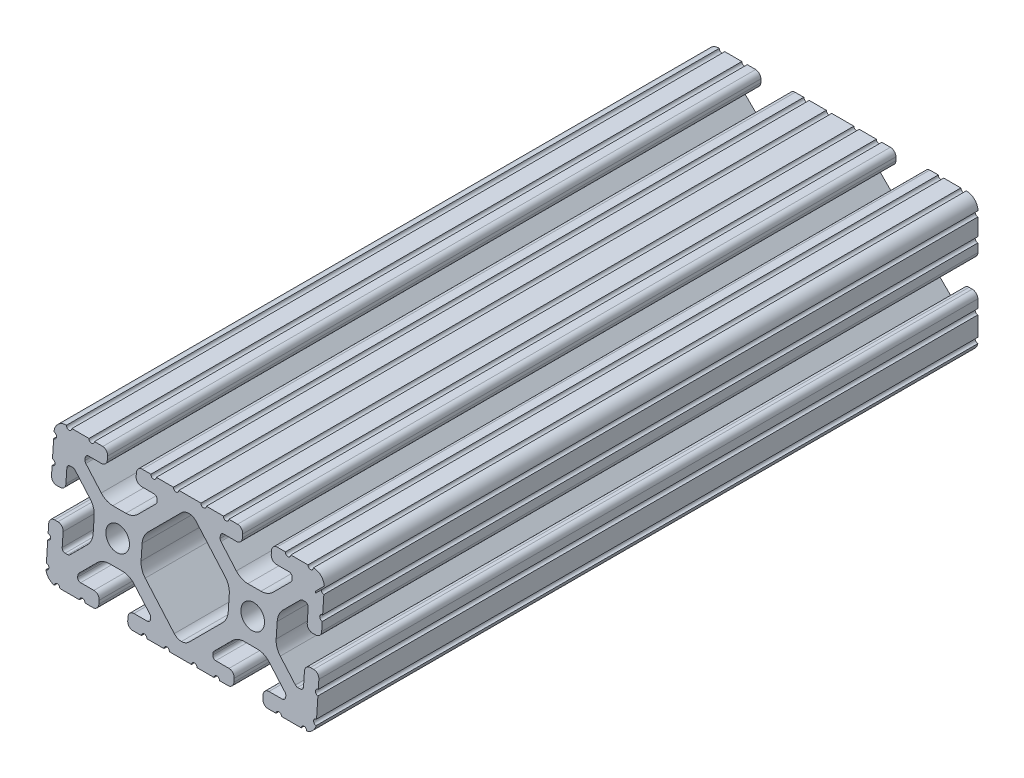
from build123d import *

# Parameters (mm, degrees)
SKETCH1_R          = 3.3274
EXTRUDE1_DEPTH     = 186.817
CUT_EXTRUDE1_DEPTH = 127


with BuildPart() as part:
    # Sketch1 → Extrude1 (new body)
    with BuildSketch(Plane.XY):
        with BuildLine():
            Line((-3.121121376, -19.05), (3.121121376, -19.05))
            ThreePointArc((3.121121376, -19.05), (3.883121376, -18.288), (4.645121376, -19.05))
            Line((4.645121376, -19.05), (8.633115796, -19.05))
            Line((8.633115796, -19.05), (9.473536067, -19.05))
            ThreePointArc((9.473536067, -19.05), (10.235536067, -18.288), (10.997536067, -19.05))
            Line((10.997536067, -19.05), (13.4112, -19.05))
            ThreePointArc((13.4112, -19.05), (14.524751759, -18.588751759), (14.986, -17.4752))
            Line((14.986, -17.4752), (14.986, -16.5608))
            ThreePointArc((14.986, -16.5608), (14.524751759, -15.447248241), (13.4112, -14.986))
            Line((13.4112, -14.986), (9.652, -14.986))
            ThreePointArc((9.652, -14.986), (9.023382072, -14.725617928), (8.763, -14.097))
            Line((8.763, -14.097), (8.763, -13.687179678))
            ThreePointArc((8.763, -13.687179678), (8.830670671, -13.346975131), (9.023380503, -13.058563318))
            Line((9.023380503, -13.058563318), (13.852498595, -8.229421131))
            ThreePointArc((13.852498595, -8.229421131), (15.393447522, -7.199787805), (17.211122763, -6.838228541))
            Line((17.211122763, -6.838228541), (20.888877237, -6.838228541))
            ThreePointArc((20.888877237, -6.838228541), (22.706552478, -7.199787805), (24.247501405, -8.229421131))
            Line((24.247501405, -8.229421131), (29.076619497, -13.058563318))
            ThreePointArc((29.076619497, -13.058563318), (29.269329329, -13.346975131), (29.337, -13.687179678))
            Line((29.337, -13.687179678), (29.337, -14.097))
            ThreePointArc((29.337, -14.097), (29.076617928, -14.725617928), (28.448, -14.986))
            Line((28.448, -14.986), (24.6888, -14.986))
            ThreePointArc((24.6888, -14.986), (23.575248241, -15.447248241), (23.114, -16.5608))
            Line((23.114, -16.5608), (23.114, -17.4752))
            ThreePointArc((23.114, -17.4752), (23.575248241, -18.588751759), (24.6888, -19.05))
            Line((24.6888, -19.05), (26.945817469, -19.05))
            ThreePointArc((26.945817469, -19.05), (27.707817469, -18.288), (28.469817469, -19.05))
            Line((28.469817469, -19.05), (29.207115796, -19.05))
            Line((29.207115796, -19.05), (34.047273398, -19.05))
            ThreePointArc((34.047273398, -19.05), (34.809273398, -18.288), (35.571273398, -19.05))
            ThreePointArc((35.571273398, -19.05), (37.207577603, -18.182738167), (38.1, -16.560019212))
            ThreePointArc((38.1, -16.560019212), (37.338, -15.798019212), (38.1, -15.036019212))
            Line((38.1, -15.036019212), (38.1, -10.287))
            Line((38.1, -10.287), (38.1, -9.549701672))
            ThreePointArc((38.1, -9.549701672), (37.338, -8.787701672), (38.1, -8.025701672))
            Line((38.1, -8.025701672), (38.1, -5.6388))
            ThreePointArc((38.1, -5.6388), (37.638751759, -4.525248241), (36.5252, -4.064))
            Line((36.5252, -4.064), (35.6108, -4.064))
            ThreePointArc((35.6108, -4.064), (34.497248241, -4.525248241), (34.036, -5.6388))
            Line((34.036, -5.6388), (34.036, -9.398))
            ThreePointArc((34.036, -9.398), (33.775617928, -10.026617928), (33.147, -10.287))
            Line((33.147, -10.287), (32.420656743, -10.287))
            ThreePointArc((32.420656743, -10.287), (32.080450147, -10.21932848), (31.792037247, -10.02661636))
            Line((31.792037247, -10.02661636), (27.197575832, -5.43213202))
            ThreePointArc((27.197575832, -5.43213202), (26.167954729, -3.891188903), (25.8064, -2.07352461))
            Line((25.8064, -2.07352461), (25.8064, 2.07352461))
            ThreePointArc((25.8064, 2.07352461), (26.167954729, 3.891188903), (27.197575832, 5.43213202))
            Line((27.197575832, 5.43213202), (31.792037247, 10.02661636))
            ThreePointArc((31.792037247, 10.02661636), (32.080450147, 10.21932848), (32.420656743, 10.287))
            Line((32.420656743, 10.287), (33.147, 10.287))
            ThreePointArc((33.147, 10.287), (33.775617928, 10.026617928), (34.036, 9.398))
            Line((34.036, 9.398), (34.036, 5.6388))
            ThreePointArc((34.036, 5.6388), (34.497248241, 4.525248241), (35.6108, 4.064))
            Line((35.6108, 4.064), (36.5252, 4.064))
            ThreePointArc((36.5252, 4.064), (37.638751759, 4.525248241), (38.1, 5.6388))
            Line((38.1, 5.6388), (38.1, 8.025701672))
            ThreePointArc((38.1, 8.025701672), (37.338, 8.787701672), (38.1, 9.549701672))
            Line((38.1, 9.549701672), (38.1, 10.287))
            Line((38.1, 10.287), (38.1, 14.375206214))
            ThreePointArc((38.1, 14.375206214), (37.338232276, 15.156019383), (38.137614868, 15.89827725))
            ThreePointArc((38.137614868, 15.89827725), (37.148019028, 18.192014021), (34.819536496, 19.096833012))
            ThreePointArc((34.819536496, 19.096833012), (34.081312886, 18.311776389), (33.296256263, 19.05))
            Line((33.296256263, 19.05), (29.207115796, 19.05))
            Line((29.207115796, 19.05), (28.469817468, 19.05))
            ThreePointArc((28.469817468, 19.05), (27.707817468, 18.288), (26.945817468, 19.05))
            Line((26.945817468, 19.05), (24.558915796, 19.05))
            ThreePointArc((24.558915796, 19.05), (23.53023695, 18.547208069), (23.114, 17.480565346))
            Line((23.114, 17.480565346), (23.114, 16.5608))
            ThreePointArc((23.114, 16.5608), (23.575248241, 15.447248241), (24.6888, 14.986))
            Line((24.6888, 14.986), (28.295243665, 14.986))
            ThreePointArc((28.295243665, 14.986), (28.923861593, 14.725617928), (29.184243665, 14.097))
            Line((29.184243665, 14.097), (29.184243665, 13.53442258))
            ThreePointArc((29.184243665, 13.53442258), (29.116572993, 13.194218033), (28.923863161, 12.90580622))
            Line((28.923863161, 12.90580622), (24.247501405, 8.229421131))
            ThreePointArc((24.247501405, 8.229421131), (22.706552478, 7.199787805), (20.888877237, 6.838228541))
            Line((20.888877237, 6.838228541), (17.211122763, 6.838228541))
            ThreePointArc((17.211122763, 6.838228541), (15.393447522, 7.199787805), (13.852498595, 8.229421131))
            Line((13.852498595, 8.229421131), (9.176136839, 12.90580622))
            ThreePointArc((9.176136839, 12.90580622), (8.983427007, 13.194218033), (8.915756335, 13.53442258))
            Line((8.915756335, 13.53442258), (8.915756335, 14.097))
            ThreePointArc((8.915756335, 14.097), (9.176138407, 14.725617928), (9.804756335, 14.986))
            Line((9.804756335, 14.986), (13.4112, 14.986))
            ThreePointArc((13.4112, 14.986), (14.524751759, 15.447248241), (14.986, 16.5608))
            Line((14.986, 16.5608), (14.986, 17.496772581))
            ThreePointArc((14.986, 17.496772581), (14.531070222, 18.595070222), (13.432772581, 19.05))
            Line((13.432772581, 19.05), (10.997536067, 19.05))
            ThreePointArc((10.997536067, 19.05), (10.235536067, 18.288), (9.473536067, 19.05))
            Line((9.473536067, 19.05), (8.633115796, 19.05))
            Line((8.633115796, 19.05), (4.645121376, 19.05))
            ThreePointArc((4.645121376, 19.05), (3.883121376, 18.288), (3.121121376, 19.05))
            Line((3.121121376, 19.05), (-3.121121376, 19.05))
            ThreePointArc((-3.121121376, 19.05), (-3.883121376, 18.288), (-4.645121376, 19.05))
            Line((-4.645121376, 19.05), (-8.633115796, 19.05))
            Line((-8.633115796, 19.05), (-9.473536067, 19.05))
            ThreePointArc((-9.473536067, 19.05), (-10.235536067, 18.288), (-10.997536067, 19.05))
            Line((-10.997536067, 19.05), (-13.432772581, 19.05))
            ThreePointArc((-13.432772581, 19.05), (-14.531070222, 18.595070222), (-14.986, 17.496772581))
            Line((-14.986, 17.496772581), (-14.986, 16.5608))
            ThreePointArc((-14.986, 16.5608), (-14.524751759, 15.447248241), (-13.4112, 14.986))
            Line((-13.4112, 14.986), (-9.804756335, 14.986))
            ThreePointArc((-9.804756335, 14.986), (-9.176138407, 14.725617928), (-8.915756335, 14.097))
            Line((-8.915756335, 14.097), (-8.915756335, 13.53442258))
            ThreePointArc((-8.915756335, 13.53442258), (-8.983427007, 13.194218033), (-9.176136839, 12.90580622))
            Line((-9.176136839, 12.90580622), (-13.852498595, 8.229421131))
            ThreePointArc((-13.852498595, 8.229421131), (-15.393447522, 7.199787805), (-17.211122763, 6.838228541))
            Line((-17.211122763, 6.838228541), (-20.888877237, 6.838228541))
            ThreePointArc((-20.888877237, 6.838228541), (-22.706552478, 7.199787805), (-24.247501405, 8.229421131))
            Line((-24.247501405, 8.229421131), (-28.923863161, 12.90580622))
            ThreePointArc((-28.923863161, 12.90580622), (-29.116572993, 13.194218033), (-29.184243665, 13.53442258))
            Line((-29.184243665, 13.53442258), (-29.184243665, 14.097))
            ThreePointArc((-29.184243665, 14.097), (-28.923861593, 14.725617928), (-28.295243665, 14.986))
            Line((-28.295243665, 14.986), (-24.6888, 14.986))
            ThreePointArc((-24.6888, 14.986), (-23.575248241, 15.447248241), (-23.114, 16.5608))
            Line((-23.114, 16.5608), (-23.114, 17.480565346))
            ThreePointArc((-23.114, 17.480565346), (-23.53023695, 18.547208069), (-24.558915796, 19.05))
            Line((-24.558915796, 19.05), (-26.945817468, 19.05))
            ThreePointArc((-26.945817468, 19.05), (-27.707817468, 18.288), (-28.469817468, 19.05))
            Line((-28.469817468, 19.05), (-29.207115796, 19.05))
            Line((-29.207115796, 19.05), (-33.296256263, 19.05))
            ThreePointArc((-33.296256263, 19.05), (-34.081312886, 18.311776389), (-34.819536496, 19.096833012))
            ThreePointArc((-34.819536496, 19.096833012), (-37.148019028, 18.192014021), (-38.137614868, 15.89827725))
            ThreePointArc((-38.137614868, 15.89827725), (-37.338232276, 15.156019383), (-38.1, 14.375206214))
            Line((-38.1, 14.375206214), (-38.1, 10.287))
            Line((-38.1, 10.287), (-38.1, 9.549701672))
            ThreePointArc((-38.1, 9.549701672), (-37.338, 8.787701672), (-38.1, 8.025701672))
            Line((-38.1, 8.025701672), (-38.1, 5.6388))
            ThreePointArc((-38.1, 5.6388), (-37.638751759, 4.525248241), (-36.5252, 4.064))
            Line((-36.5252, 4.064), (-35.6108, 4.064))
            ThreePointArc((-35.6108, 4.064), (-34.497248241, 4.525248241), (-34.036, 5.6388))
            Line((-34.036, 5.6388), (-34.036, 9.398))
            ThreePointArc((-34.036, 9.398), (-33.775617928, 10.026617928), (-33.147, 10.287))
            Line((-33.147, 10.287), (-32.420656743, 10.287))
            ThreePointArc((-32.420656743, 10.287), (-32.080450147, 10.21932848), (-31.792037247, 10.02661636))
            Line((-31.792037247, 10.02661636), (-27.197575832, 5.43213202))
            ThreePointArc((-27.197575832, 5.43213202), (-26.167954729, 3.891188903), (-25.8064, 2.07352461))
            Line((-25.8064, 2.07352461), (-25.8064, -2.07352461))
            ThreePointArc((-25.8064, -2.07352461), (-26.167954729, -3.891188903), (-27.197575832, -5.43213202))
            Line((-27.197575832, -5.43213202), (-31.792037247, -10.02661636))
            ThreePointArc((-31.792037247, -10.02661636), (-32.080450147, -10.21932848), (-32.420656743, -10.287))
            Line((-32.420656743, -10.287), (-33.147, -10.287))
            ThreePointArc((-33.147, -10.287), (-33.775617928, -10.026617928), (-34.036, -9.398))
            Line((-34.036, -9.398), (-34.036, -5.6388))
            ThreePointArc((-34.036, -5.6388), (-34.497248241, -4.525248241), (-35.6108, -4.064))
            Line((-35.6108, -4.064), (-36.5252, -4.064))
            ThreePointArc((-36.5252, -4.064), (-37.638751759, -4.525248241), (-38.1, -5.6388))
            Line((-38.1, -5.6388), (-38.1, -8.025701672))
            ThreePointArc((-38.1, -8.025701672), (-37.338, -8.787701672), (-38.1, -9.549701672))
            Line((-38.1, -9.549701672), (-38.1, -10.287))
            Line((-38.1, -10.287), (-38.1, -15.036019212))
            ThreePointArc((-38.1, -15.036019212), (-37.338, -15.798019212), (-38.1, -16.560019212))
            ThreePointArc((-38.1, -16.560019212), (-37.20882252, -18.184002456), (-35.571273398, -19.05))
            ThreePointArc((-35.571273398, -19.05), (-34.809273398, -18.288), (-34.047273398, -19.05))
            Line((-34.047273398, -19.05), (-29.207115796, -19.05))
            Line((-29.207115796, -19.05), (-28.469817469, -19.05))
            ThreePointArc((-28.469817469, -19.05), (-27.707817469, -18.288), (-26.945817469, -19.05))
            Line((-26.945817469, -19.05), (-24.6888, -19.05))
            ThreePointArc((-24.6888, -19.05), (-23.575248241, -18.588751759), (-23.114, -17.4752))
            Line((-23.114, -17.4752), (-23.114, -16.5608))
            ThreePointArc((-23.114, -16.5608), (-23.575248241, -15.447248241), (-24.6888, -14.986))
            Line((-24.6888, -14.986), (-28.448, -14.986))
            ThreePointArc((-28.448, -14.986), (-29.076617928, -14.725617928), (-29.337, -14.097))
            Line((-29.337, -14.097), (-29.337, -13.687179678))
            ThreePointArc((-29.337, -13.687179678), (-29.269329329, -13.346975131), (-29.076619497, -13.058563318))
            Line((-29.076619497, -13.058563318), (-24.247501405, -8.229421131))
            ThreePointArc((-24.247501405, -8.229421131), (-22.706552478, -7.199787805), (-20.888877237, -6.838228541))
            Line((-20.888877237, -6.838228541), (-17.211122763, -6.838228541))
            ThreePointArc((-17.211122763, -6.838228541), (-15.393447522, -7.199787805), (-13.852498595, -8.229421131))
            Line((-13.852498595, -8.229421131), (-9.023380503, -13.058563318))
            ThreePointArc((-9.023380503, -13.058563318), (-8.830670671, -13.346975131), (-8.763, -13.687179678))
            Line((-8.763, -13.687179678), (-8.763, -14.097))
            ThreePointArc((-8.763, -14.097), (-9.023382072, -14.725617928), (-9.652, -14.986))
            Line((-9.652, -14.986), (-13.4112, -14.986))
            ThreePointArc((-13.4112, -14.986), (-14.524751759, -15.447248241), (-14.986, -16.5608))
            Line((-14.986, -16.5608), (-14.986, -17.4752))
            ThreePointArc((-14.986, -17.4752), (-14.524751759, -18.588751759), (-13.4112, -19.05))
            Line((-13.4112, -19.05), (-10.997536067, -19.05))
            ThreePointArc((-10.997536067, -19.05), (-10.235536067, -18.288), (-9.473536067, -19.05))
            Line((-9.473536067, -19.05), (-8.633115796, -19.05))
            Line((-8.633115796, -19.05), (-4.645121376, -19.05))
            ThreePointArc((-4.645121376, -19.05), (-3.883121376, -18.288), (-3.121121376, -19.05))
        make_face()
        with Locations((19.05, 0)):
            Circle(SKETCH1_R, mode=Mode.SUBTRACT)
        with Locations(Location((-19.05, 0, 0), (0, 0, 180))):
            Circle(SKETCH1_R, mode=Mode.SUBTRACT)
        with BuildLine():
            Line((2.077035361, 14.257564863), (10.902424168, 5.43213202))
            ThreePointArc((10.902424168, 5.43213202), (11.932045271, 3.891188903), (12.2936, 2.07352461))
            Line((12.2936, 2.07352461), (12.2936, -2.07352461))
            ThreePointArc((12.2936, -2.07352461), (11.932045271, -3.891188903), (10.902424168, -5.43213202))
            Line((10.902424168, -5.43213202), (2.077035361, -14.257564863))
            ThreePointArc((2.077035361, -14.257564863), (1.124045601, -14.892973012), (0, -15.113096807))
            ThreePointArc((0, -15.113096807), (-1.124045601, -14.892973012), (-2.077035361, -14.257564863))
            Line((-2.077035361, -14.257564863), (-10.902424168, -5.43213202))
            ThreePointArc((-10.902424168, -5.43213202), (-11.932045271, -3.891188903), (-12.2936, -2.07352461))
            Line((-12.2936, -2.07352461), (-12.2936, 2.07352461))
            ThreePointArc((-12.2936, 2.07352461), (-11.932045271, 3.891188903), (-10.902424168, 5.43213202))
            Line((-10.902424168, 5.43213202), (-2.077035361, 14.257564863))
            ThreePointArc((-2.077035361, 14.257564863), (-1.124045601, 14.892973012), (0, 15.113096807))
            ThreePointArc((0, 15.113096807), (1.124045601, 14.892973012), (2.077035361, 14.257564863))
        make_face(mode=Mode.SUBTRACT)
    extrude(amount=-EXTRUDE1_DEPTH)

    # Sketch2 → Cut-Extrude1 (cut)
    with BuildSketch(Plane(origin=(38.1, 0, 0), x_dir=(0, 0, -1), z_dir=(1, 0, 0))):
        Polygon((0, -19.05), (0, 19.097909589), (2.6675617, 19.097909589), align=None)
    extrude(amount=-CUT_EXTRUDE1_DEPTH, mode=Mode.SUBTRACT)


solid = part.part
